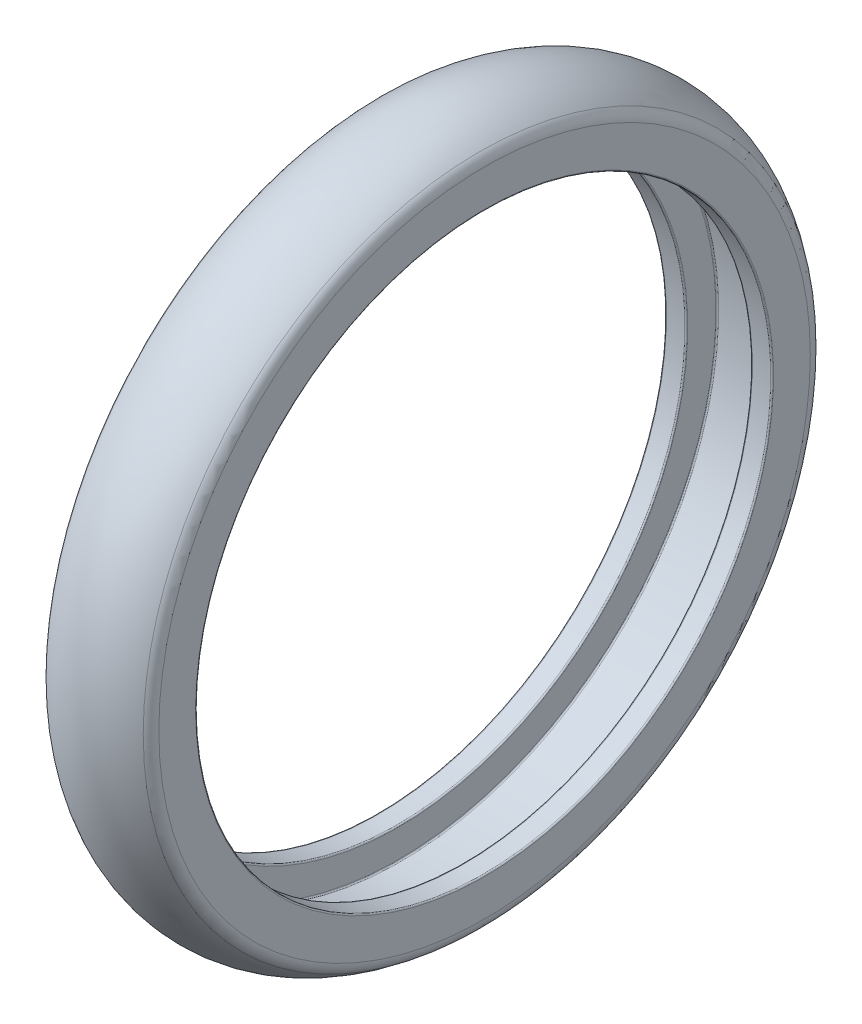
from build123d import *


with BuildPart() as part:
    # Sketch1 → Revolve1 (revolve)
    with BuildSketch(Plane.XY, mode=Mode.PRIVATE) as revolve1_sk:
        with BuildLine():
            Line((-1.774825, 18.288), (1.774825, 18.288))
            ThreePointArc((1.774825, 18.288), (1.830951601, 18.264751601), (1.8542, 18.208625))
            Line((1.8542, 18.208625), (1.8542, 16.589375))
            ThreePointArc((1.8542, 16.589375), (1.877448399, 16.533248399), (1.933575, 16.51))
            Line((1.933575, 16.51), (2.994025, 16.51))
            ThreePointArc((2.994025, 16.51), (3.050151601, 16.533248399), (3.0734, 16.589375))
            Line((3.0734, 16.589375), (3.0734, 18.700642356))
            ThreePointArc((3.0734, 18.700642356), (2.998495613, 19.037243079), (2.787919567, 19.310315309))
            ThreePointArc((2.787919567, 19.310315309), (0, 20.32), (-2.787919567, 19.310315309))
            ThreePointArc((-2.787919567, 19.310315309), (-2.998495613, 19.037243079), (-3.0734, 18.700642356))
            Line((-3.0734, 18.700642356), (-3.0734, 16.589375))
            ThreePointArc((-3.0734, 16.589375), (-3.050151601, 16.533248399), (-2.994025, 16.51))
            Line((-2.994025, 16.51), (-1.933575, 16.51))
            ThreePointArc((-1.933575, 16.51), (-1.877448399, 16.533248399), (-1.8542, 16.589375))
            Line((-1.8542, 16.589375), (-1.8542, 18.208625))
            ThreePointArc((-1.8542, 18.208625), (-1.830951601, 18.264751601), (-1.774825, 18.288))
        make_face()
    revolve(revolve1_sk.sketch.rotate(Axis((0, 0, 0), (1, 0, 0)), 90), axis=Axis((0, 0, 0), (1, 0, 0)))


solid = part.part
